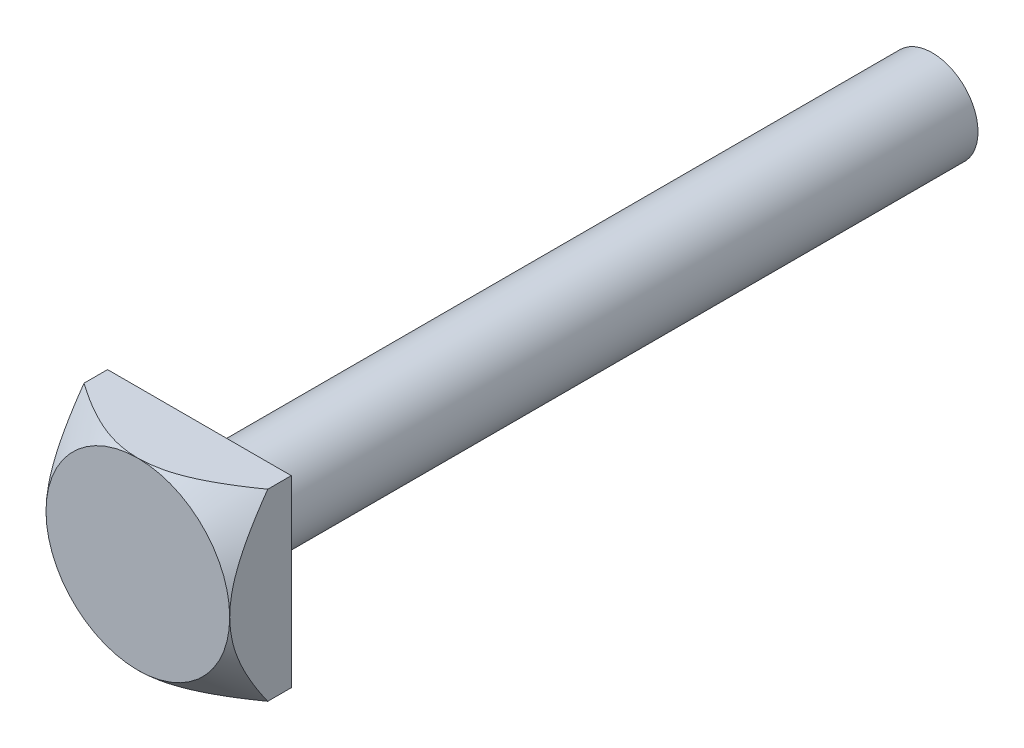
from build123d import *

# Parameters (mm, degrees)
SKETCH1_W           = 19.1
SKETCH1_H           = 19.1
BOSS_EXTRUDE1_DEPTH = 6.4
SKETCH2_R           = 4.75
BOSS_EXTRUDE2_DEPTH = 76.2
SKETCH3_OUTSIDE_W   = 51.28
SKETCH3_OUTSIDE_H   = 51.28
SKETCH3_OUTSIDE_R   = 9.55
CUT_EXTRUDE2_DEPTH  = 6.4
CUT_EXTRUDE2_DRAFT  = -45


with BuildPart() as part:
    # Sketch1 → Boss-Extrude1 (new body)
    with BuildSketch(Plane.XY):
        Rectangle(SKETCH1_W, SKETCH1_H)
    extrude(amount=-BOSS_EXTRUDE1_DEPTH)

    # Sketch2 → Boss-Extrude2 (add)
    with BuildSketch(Plane(origin=(0, 0, -6.4), x_dir=(-1, 0, 0), z_dir=(0, 0, -1))):
        with Locations(Location((0, 0, 0), (0, 0, 180))):
            Circle(SKETCH2_R)
    extrude(amount=BOSS_EXTRUDE2_DEPTH)


with BuildPart() as cut_extrude2_tool:
    # Sketch3 outside → Cut-Extrude2 (with draft: the straight prism first)
    with BuildSketch(Plane.XY):
        Rectangle(SKETCH3_OUTSIDE_W, SKETCH3_OUTSIDE_H)
        Circle(SKETCH3_OUTSIDE_R, mode=Mode.SUBTRACT)
    extrude(amount=-CUT_EXTRUDE2_DEPTH)
    # Cut-Extrude2: the draft: its side faces are tilted about the plane it starts from
    cut_extrude2_sides = [cut_extrude2_tool.faces().sort_by_distance(p)[0] for p in [
        (0, -25.64, -3.2),
        (25.64, 0, -3.2),
        (0, 25.64, -3.2),
        (-25.64, 0, -3.2),
        (-9.55, 0, -3.2),
    ]]
    draft(cut_extrude2_sides, Plane.XY, CUT_EXTRUDE2_DRAFT)


with BuildPart() as part_1:
    add(part.part)

    # Cut-Extrude2: cut by cut_extrude2_tool
    add(cut_extrude2_tool.part, mode=Mode.SUBTRACT)


solid = part_1.part
